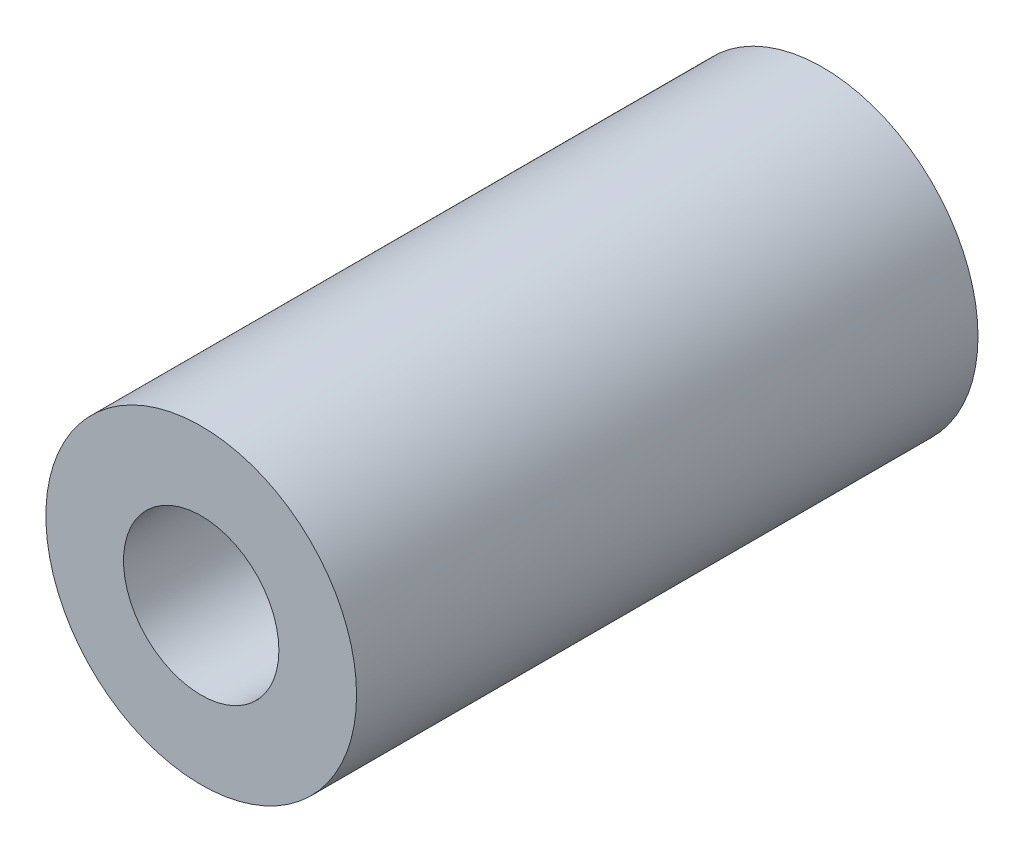
from build123d import *

# Parameters (mm, degrees)
SKETCH_1_R      = 2
SKETCH_1_R_2    = 1
EXTRUDE_1_DEPTH = 8


with BuildPart() as part:
    # 草图1 → 凸台-拉伸1 (new body)
    with BuildSketch(Plane.XY):
        Circle(SKETCH_1_R)
        Circle(SKETCH_1_R_2, mode=Mode.SUBTRACT)
    extrude(amount=EXTRUDE_1_DEPTH)


solid = part.part
